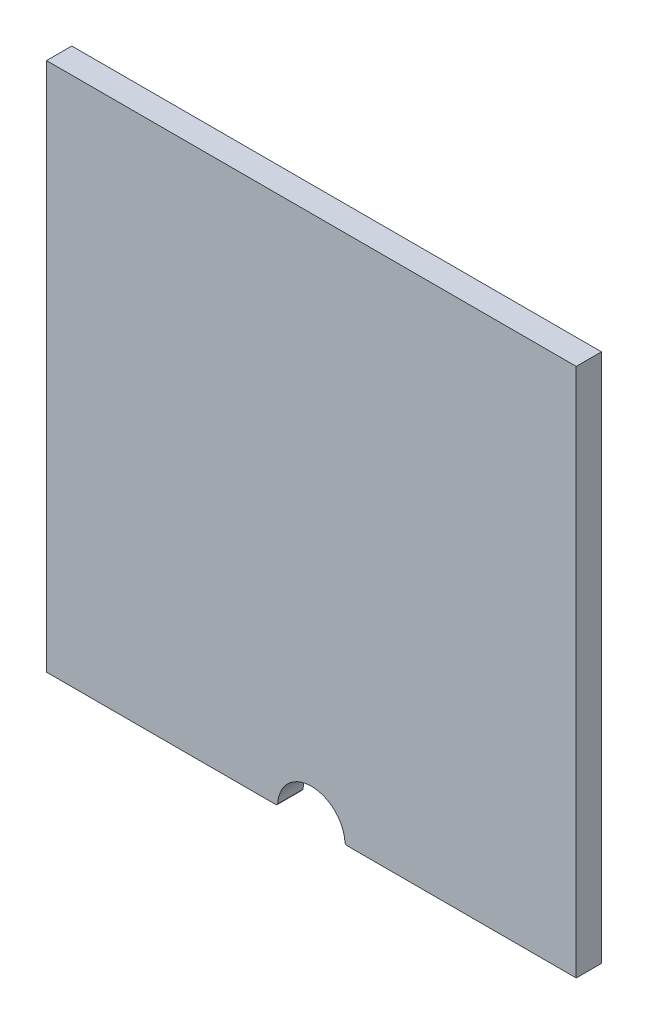
from build123d import *

# Parameters (mm, degrees)
SKETCH1_W           = 200
SKETCH1_H           = 200
BOSS_EXTRUDE1_DEPTH = 9.525
SKETCH5_W           = 200
SKETCH5_H           = 200
SKETCH5_W_2         = 199.8984
SKETCH5_H_2         = 199.8984
CUT_EXTRUDE2_DEPTH  = 284.003048791
CUT_EXTRUDE1_DEPTH  = 9.525
FILLET1_R           = 0.79375


with BuildPart() as part:
    # Sketch1 → Boss-Extrude1 (new body)
    with BuildSketch(Plane.XY):
        with Locations((100, 100)):
            Rectangle(SKETCH1_W, SKETCH1_H)
    extrude(amount=BOSS_EXTRUDE1_DEPTH)

    # Sketch5 → Cut-Extrude2 (cut, through all)
    with BuildSketch(Plane.XY.offset(9.525)):
        with Locations((100, 100)):
            Rectangle(SKETCH5_W, SKETCH5_H)
        with Locations((100, 100)):
            Rectangle(SKETCH5_W_2, SKETCH5_H_2, mode=Mode.SUBTRACT)
    extrude(amount=-CUT_EXTRUDE2_DEPTH, mode=Mode.SUBTRACT)

    # Sketch2 → Cut-Extrude1 (cut)
    with BuildSketch(Plane.XY.offset(9.525)):
        with BuildLine():
            Line((87.3, 0.0508), (112.7, 0.0508))
            ThreePointArc((112.7, 0.0508), (100, 12.7508), (87.3, 0.0508))
        make_face()
    extrude(amount=-CUT_EXTRUDE1_DEPTH, mode=Mode.SUBTRACT)

    # Fillet1
    fillet1_edges = [part.edges().sort_by_distance(p)[0] for p in [
        (87.3, 0.0508, 4.7625),
        (112.7, 0.0508, 4.7625),
    ]]
    fillet(fillet1_edges, radius=FILLET1_R)


solid = part.part
